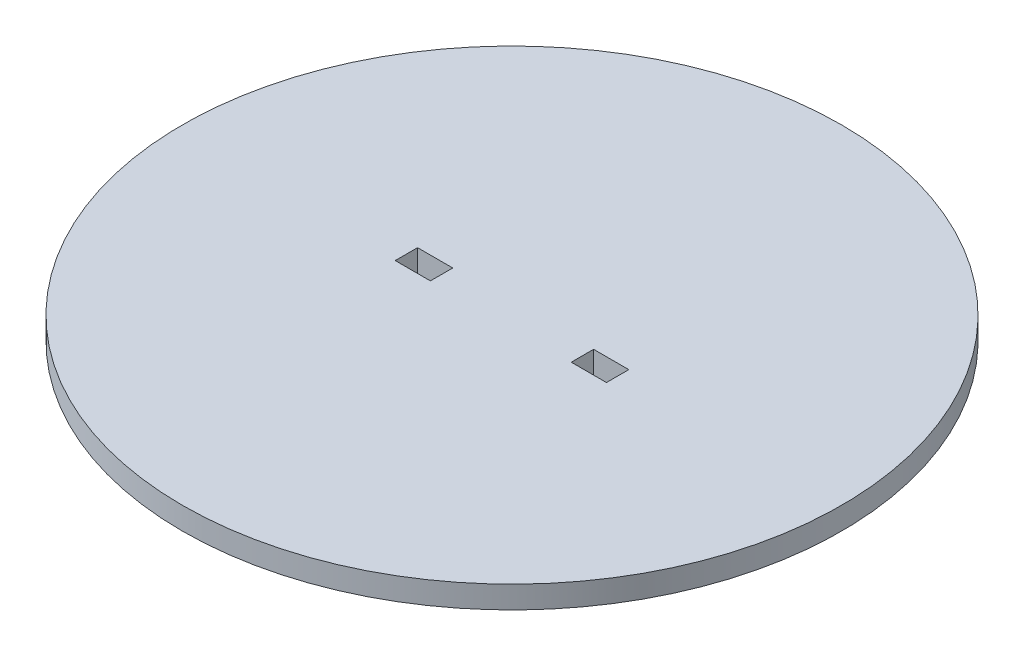
from build123d import *

# Parameters (mm, degrees)
SKETCH1_R           = 46.8
SKETCH1_W           = 5
SKETCH1_H           = 3.175
BOSS_EXTRUDE1_DEPTH = 3.175


with BuildPart() as part:
    # Sketch1 → Boss-Extrude1 (new body)
    with BuildSketch(Plane(origin=(0, 0, 0), x_dir=(1, 0, 0), z_dir=(0, 1, 0))):
        with Locations(Location((0, 0, 0), (0, 0, 270))):
            Circle(SKETCH1_R)
        with Locations((-12.5, 0)):
            Rectangle(SKETCH1_W, SKETCH1_H, mode=Mode.SUBTRACT)
        with Locations((12.5, 0)):
            Rectangle(SKETCH1_W, SKETCH1_H, mode=Mode.SUBTRACT)
    extrude(amount=BOSS_EXTRUDE1_DEPTH)


solid = part.part
